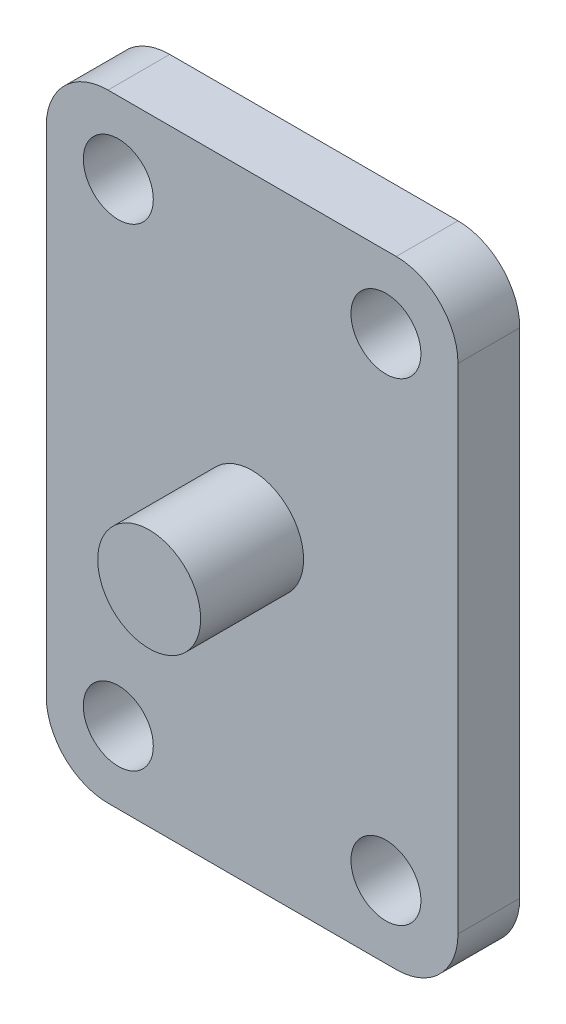
from build123d import *

# Parameters (mm, degrees)
SKETCH1_W                  = 20
SKETCH1_H                  = 30
BOSS_EXTRUDE1_DEPTH        = 3
F_3_4_3_4_DIAMETER_HOLE1_D = 3.4
SKETCH5_R                  = 3.4
CUT_EXTRUDE1_DEPTH         = 0.5
FILLET1_R                  = 3
SKETCH7_W                  = 8
SKETCH7_H                  = 15
BOSS_EXTRUDE3_DEPTH        = 11
CUT_EXTRUDE3_DEPTH         = 25.839484697
CUT_EXTRUDE3_DEPTH_BACK    = 25.839484697
SKETCH11_OUTSIDE_W         = 29.736
SKETCH11_OUTSIDE_H         = 39.736
SKETCH11_OUTSIDE_R         = 2.5
CUT_EXTRUDE4_DEPTH         = 22.118712082
SKETCH12_W                 = 7.43023475
SKETCH12_H                 = 21.108621448
CUT_EXTRUDE5_DEPTH         = 29.653097564
SKETCH13_R                 = 3.4
SKETCH13_R_2               = 2.75
BOSS_EXTRUDE4_DEPTH        = 0.5


with BuildPart() as part:
    # Sketch1 → Boss-Extrude1 (new body)
    with BuildSketch(Plane.XY):
        Rectangle(SKETCH1_W, SKETCH1_H)
    extrude(amount=BOSS_EXTRUDE1_DEPTH)

    # Ø3.4 (3.4) Diameter Hole1 (through all)
    with Locations(Plane.XY.offset(3)):
        with Locations((-6.5, 11.5), (6.5, 11.5), (6.5, -11.5), (-6.5, -11.5)):
            Hole(F_3_4_3_4_DIAMETER_HOLE1_D / 2)

    # Sketch5 → Cut-Extrude1 (cut)
    with BuildSketch(Plane(origin=(0, 0, 0), x_dir=(-1, 0, 0), z_dir=(0, 0, -1))):
        Circle(SKETCH5_R)
    extrude(amount=-CUT_EXTRUDE1_DEPTH, mode=Mode.SUBTRACT)

    # Fillet1
    fillet1_edges = [part.edges().sort_by_distance(p)[0] for p in [
        (10, -15, 1.5),
        (-10, -15, 1.5),
        (-10, 15, 1.5),
        (10, 15, 1.5),
    ]]
    fillet(fillet1_edges, radius=FILLET1_R)

    # Sketch7 → Boss-Extrude3 (add)
    with BuildSketch(Plane.XY.offset(3)):
        Rectangle(SKETCH7_W, SKETCH7_H)
    extrude(amount=BOSS_EXTRUDE3_DEPTH)

    # Sketch8 → Cut-Extrude3 (cut, two sides: drawn at the far end of the back side and taken through both)
    with BuildSketch(Plane(origin=(4, 0, 0), x_dir=(0, 0, -1), z_dir=(1, 0, 0)).offset(-CUT_EXTRUDE3_DEPTH_BACK)):
        Polygon((-14, -6), (-14, -7), (-13.133974596, -6.5), align=None)
        Polygon((-13.133974596, -7.5), (-14, -7), (-14, -7.5), align=None)
        Polygon((-14, -5), (-14, -6), (-13.133974596, -5.5), align=None)
        Polygon((-14, -4), (-14, -5), (-13.133974596, -4.5), align=None)
        Polygon((-14, -3), (-14, -4), (-13.133974596, -3.5), align=None)
        Polygon((-14, 7), (-13.133974596, 7.5), (-14, 7.5), align=None)
        Polygon((-14, -2), (-14, -3), (-13.133974596, -2.5), align=None)
        Polygon((-13.133974596, 6.5), (-14, 7), (-14, 6), align=None)
        Polygon((-14, -1), (-14, -2), (-13.133974596, -1.5), align=None)
        Polygon((-13.133974596, 5.5), (-14, 6), (-14, 5), align=None)
        Polygon((-14, 0), (-14, -1), (-13.133974596, -0.5), align=None)
        Polygon((-13.133974596, 4.5), (-14, 5), (-14, 4), align=None)
        Polygon((-14, 1), (-14, 0), (-13.133974596, 0.5), align=None)
        Polygon((-13.133974596, 3.5), (-14, 4), (-14, 3), align=None)
        Polygon((-14, 2), (-14, 1), (-13.133974596, 1.5), align=None)
        Polygon((-13.133974596, 2.5), (-14, 3), (-14, 2), align=None)
    extrude(amount=CUT_EXTRUDE3_DEPTH + CUT_EXTRUDE3_DEPTH_BACK, mode=Mode.SUBTRACT)

    # Sketch11 outside → Cut-Extrude4 (cut, through all)
    with BuildSketch(Plane.XY.offset(3)):
        Rectangle(SKETCH11_OUTSIDE_W, SKETCH11_OUTSIDE_H)
        Circle(SKETCH11_OUTSIDE_R, mode=Mode.SUBTRACT)
    extrude(amount=CUT_EXTRUDE4_DEPTH, mode=Mode.SUBTRACT)

    # Sketch12 → Cut-Extrude5 (cut, through all)
    with BuildSketch(Plane(origin=(10, 0, 0), x_dir=(0, 0, -1), z_dir=(1, 0, 0))):
        with Locations((-11.715117375, -0.112579314)):
            Rectangle(SKETCH12_W, SKETCH12_H)
    extrude(amount=-CUT_EXTRUDE5_DEPTH, mode=Mode.SUBTRACT)

    # Sketch13 → Boss-Extrude4 (add)
    with BuildSketch(Plane(origin=(0, 0, 0), x_dir=(-1, 0, 0), z_dir=(0, 0, -1))):
        Circle(SKETCH13_R)
        Circle(SKETCH13_R_2, mode=Mode.SUBTRACT)
    extrude(amount=-BOSS_EXTRUDE4_DEPTH)


solid = part.part
